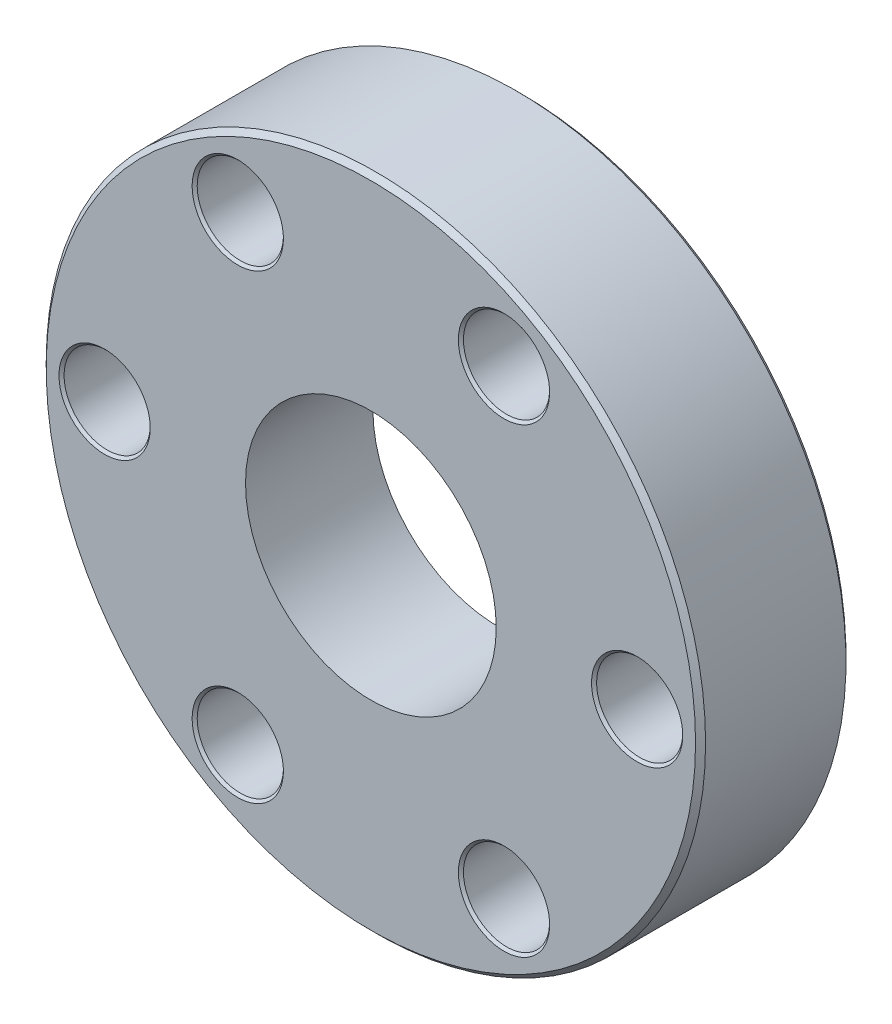
from build123d import *

# Parameters (mm, degrees)
CHAMFER1_SIZE     = 0.254
CIRPATTERN1_COUNT = 6


with BuildPart() as part:
    # Sketch1 → Revolve1 (revolve)
    with BuildSketch(Plane(origin=(0, 0, 0), x_dir=(0, 0, -1), z_dir=(1, 0, 0)), mode=Mode.PRIVATE) as revolve1_sk:
        Polygon((0, 16.7005), (0, 10.795), (-0.973909372, 10.795), (-0.6604, 9.017), (-1.1684, 9.017), (-1.1684, 6.35), (-7.62, 6.35), (-7.62, 16.7005), align=None)
    revolve(revolve1_sk.sketch.rotate(Axis((0, 0, 0), (0, 0, 1)), 90), axis=Axis((0, 0, 0), (0, 0, 1)))

    # Chamfer1
    chamfer1_edges = [part.edges().sort_by_distance(p)[0] for p in [
        (16.7005, 0, 0),
        (16.7005, 0, 7.62),
    ]]
    chamfer(chamfer1_edges, length=CHAMFER1_SIZE)

    # Sketch2 → 11/64 (0.17188) Diameter Hole2 (revolve, cut)
    with BuildSketch(Plane.YZ.offset(13.4874)):
        Polygon((0, 0), (0, 7.62), (2.3114, 7.62), (2.182876, 7.491476), (2.182876, 0.128524), (2.3114, 0), align=None)
    f_11_64_0_17188_diameter_hole2 = revolve(axis=Axis((13.4874, 0, -6.35), (0, 0, 1)), mode=Mode.SUBTRACT)

    # CirPattern1: 11/64 (0.17188) Diameter Hole2 ×6 about axis
    cirpattern1_axis = Axis((0, 0, 0), (0, 0, 1))
    for i in range(1, CIRPATTERN1_COUNT):
        add(f_11_64_0_17188_diameter_hole2.rotate(cirpattern1_axis, i * 360 / CIRPATTERN1_COUNT), mode=Mode.SUBTRACT)


solid = part.part
